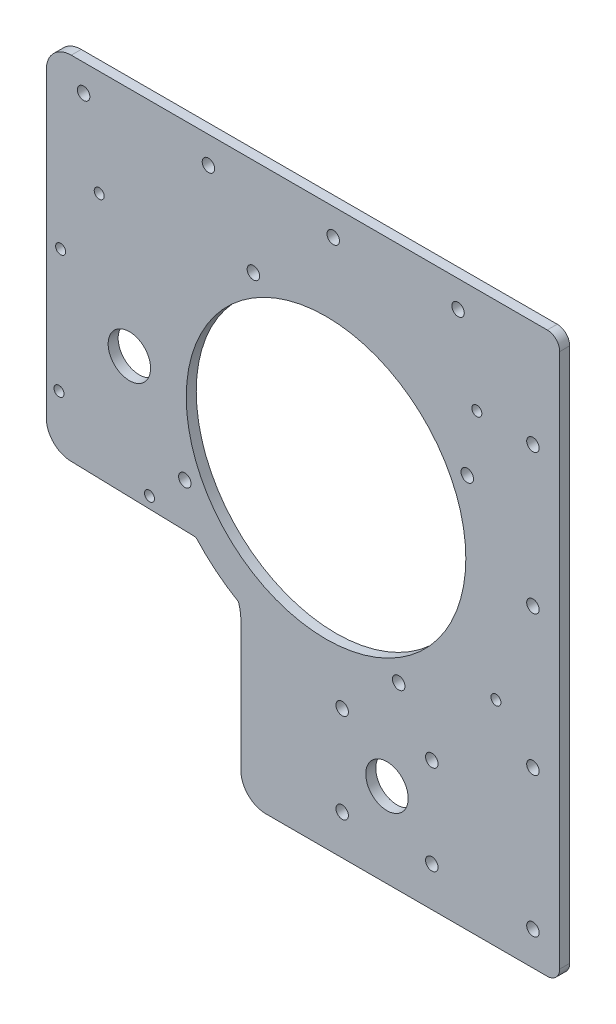
from build123d import *

# Parameters (mm, degrees)
SKETCH1_R           = 56
SKETCH1_R_2         = 2
SKETCH1_R_3         = 2.5
BOSS_EXTRUDE1_DEPTH = 4
SKETCH4_R           = 8.5
CUT_EXTRUDE2_DEPTH  = 171.674300953
SKETCH6_R           = 8.5
CUT_EXTRUDE4_DEPTH  = 171.674300953
SKETCH7_R           = 2.5
CUT_EXTRUDE5_DEPTH  = 171.674300953
BOSS_EXTRUDE3_DEPTH = 4


with BuildPart() as part:
    # Sketch1 → Boss-Extrude1 (new body)
    with BuildSketch(Plane.XY):
        with BuildLine():
            Line((-112.067145126, 20.879542552), (-112.067145126, -35.368944903))
            ThreePointArc((-112.067145126, -35.368944903), (-109.233115964, -42.343818518), (-102.337372736, -45.365293088))
            Line((-102.337372736, -45.365293088), (-53.565458311, -46.683726342))
            ThreePointArc((-53.565458311, -46.683726342), (-39.773971855, -52.726675482), (-34.105913531, -66.676422713))
            Line((-34.105913531, -66.676422713), (-34.105913531, -118.664960222))
            ThreePointArc((-34.105913531, -118.664960222), (-31.176981342, -125.736028034), (-24.105913531, -128.664960222))
            Line((-24.105913531, -128.664960222), (58.614189281, -128.664960222))
            Line((58.614189281, -128.664960222), (88.614189281, -128.664960222))
            ThreePointArc((88.614189281, -128.664960222), (92.149723187, -127.200494128), (93.614189281, -123.664960222))
            Line((93.614189281, -123.664960222), (93.614189281, 90.572680082))
            ThreePointArc((93.614189281, 90.572680082), (92.149723187, 94.108213988), (88.614189281, 95.572680082))
            Line((88.614189281, 95.572680082), (58.614189281, 95.572680082))
            Line((58.614189281, 95.572680082), (-0.097235187, 95.572680082))
            Line((-0.097235187, 95.572680082), (-102.067145126, 95.572680082))
            ThreePointArc((-102.067145126, 95.572680082), (-109.138212938, 92.643747894), (-112.067145126, 85.572680082))
            Line((-112.067145126, 85.572680082), (-112.067145126, 20.879542552))
        make_face()
        Circle(SKETCH1_R, mode=Mode.SUBTRACT)
        with Locations((-90.866128835, 53.212776201)):
            Circle(SKETCH1_R_2, mode=Mode.SUBTRACT)
        with Locations((60.411582215, 53.410160046)):
            Circle(SKETCH1_R_2, mode=Mode.SUBTRACT)
        with Locations((68.053955118, -43.027190126)):
            Circle(SKETCH1_R_2, mode=Mode.SUBTRACT)
        with Locations((-70.733552477, -41.68716468)):
            Circle(SKETCH1_R_2, mode=Mode.SUBTRACT)
        with Locations((29.113560385, -56.573326106)):
            Circle(SKETCH1_R_3, mode=Mode.SUBTRACT)
        with Locations((-106.987586177, -23.437423897)):
            Circle(SKETCH1_R_2, mode=Mode.SUBTRACT)
        with Locations((-106.333483393, 26.197806711)):
            Circle(SKETCH1_R_2, mode=Mode.SUBTRACT)
        with Locations((-97.118043766, 84.840447035)):
            Circle(SKETCH1_R_3, mode=Mode.SUBTRACT)
        with Locations((82.881956234, -115.159552965)):
            Circle(SKETCH1_R_3, mode=Mode.SUBTRACT)
        with Locations((-56.573326106, -29.113560385)):
            Circle(SKETCH1_R_3, mode=Mode.SUBTRACT)
        with Locations((-29.113560385, 56.573326106)):
            Circle(SKETCH1_R_3, mode=Mode.SUBTRACT)
        with Locations((56.573326106, 29.113560385)):
            Circle(SKETCH1_R_3, mode=Mode.SUBTRACT)
        with Locations((-47.118043766, 84.840447035)):
            Circle(SKETCH1_R_3, mode=Mode.SUBTRACT)
        with Locations((2.881956234, 84.840447035)):
            Circle(SKETCH1_R_3, mode=Mode.SUBTRACT)
        with Locations((52.881956234, 84.840447035)):
            Circle(SKETCH1_R_3, mode=Mode.SUBTRACT)
        with Locations((82.881956234, -59.119552965)):
            Circle(SKETCH1_R_3, mode=Mode.SUBTRACT)
        with Locations((82.881956234, -3.079552965)):
            Circle(SKETCH1_R_3, mode=Mode.SUBTRACT)
        with Locations((82.881956234, 52.960447035)):
            Circle(SKETCH1_R_3, mode=Mode.SUBTRACT)
    extrude(amount=BOSS_EXTRUDE1_DEPTH)

    # Sketch4 → Cut-Extrude2 (cut, through all)
    with BuildSketch(Plane(origin=(0, 0, 0), x_dir=(-1, 0, 0), z_dir=(0, 0, -1))):
        with Locations((-24.413036242, -94.796918523)):
            Circle(SKETCH4_R)
    extrude(amount=-CUT_EXTRUDE2_DEPTH, mode=Mode.SUBTRACT)

    # Sketch6 → Cut-Extrude4 (cut, through all)
    with BuildSketch(Plane.XY.offset(4)):
        with Locations((-78.790468385, 2.794224701)):
            Circle(SKETCH6_R)
    extrude(amount=-CUT_EXTRUDE4_DEPTH, mode=Mode.SUBTRACT)

    # Sketch7 → Cut-Extrude5 (cut, through all)
    with BuildSketch(Plane.XY.offset(4)):
        with Locations((42.373548484, -76.836406281)):
            Circle(SKETCH7_R)
        with Locations((6.452523999, -112.757430765)):
            Circle(SKETCH7_R)
        with Locations((6.452523999, -76.836406281)):
            Circle(SKETCH7_R)
        with Locations((42.373548484, -112.757430765)):
            Circle(SKETCH7_R)
    extrude(amount=-CUT_EXTRUDE5_DEPTH, mode=Mode.SUBTRACT)

    # Sketch8 → Boss-Extrude3 (add)
    with BuildSketch(Plane.XY.offset(4)):
        with BuildLine():
            Line((-52.172571307, -46.669291865), (-39.028626082, -47.635255681))
            Line((-39.028626082, -47.635255681), (-0.218247557, -69.999659771))
            ThreePointArc((-0.218247557, -69.999659771), (-28.675355133, -63.857059187), (-52.172571307, -46.669291865))
        make_face()
    extrude(amount=-BOSS_EXTRUDE3_DEPTH)


solid = part.part
